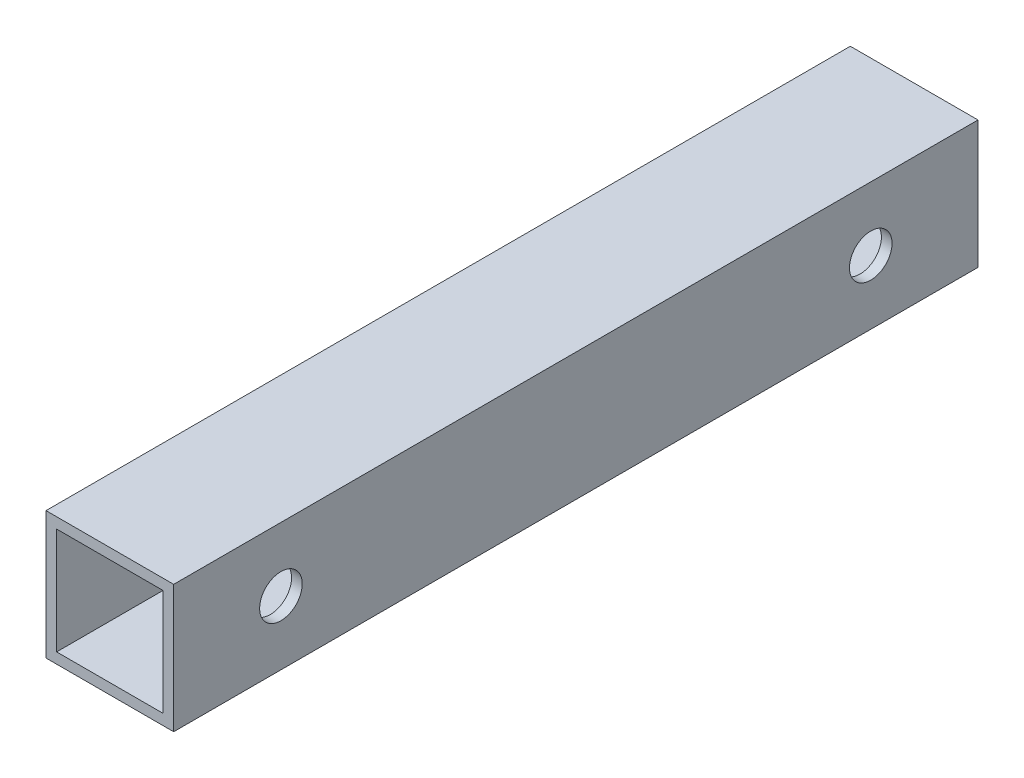
from build123d import *

# Parameters (mm, degrees)
SKETCH1_W           = 4.7625
SKETCH1_H           = 4.7625
SKETCH1_W_2         = 3.96875
SKETCH1_H_2         = 3.96875
BOSS_EXTRUDE1_DEPTH = 15
SKETCH2_R           = 0.79375
CUT_EXTRUDE1_DEPTH  = 16.917027292


with BuildPart() as part:
    # Sketch1 → Boss-Extrude1 (new, symmetric)
    with BuildSketch(Plane.XY):
        Rectangle(SKETCH1_W, SKETCH1_H)
        Rectangle(SKETCH1_W_2, SKETCH1_H_2, mode=Mode.SUBTRACT)
    extrude(amount=BOSS_EXTRUDE1_DEPTH, both=True)

    # Sketch2 → Cut-Extrude1 (cut, through all)
    with BuildSketch(Plane.ZY.offset(2.38125)):
        with Locations((-11, 0)):
            Circle(SKETCH2_R)
        with Locations((11, 0)):
            Circle(SKETCH2_R)
    extrude(amount=-CUT_EXTRUDE1_DEPTH, mode=Mode.SUBTRACT)


solid = part.part
